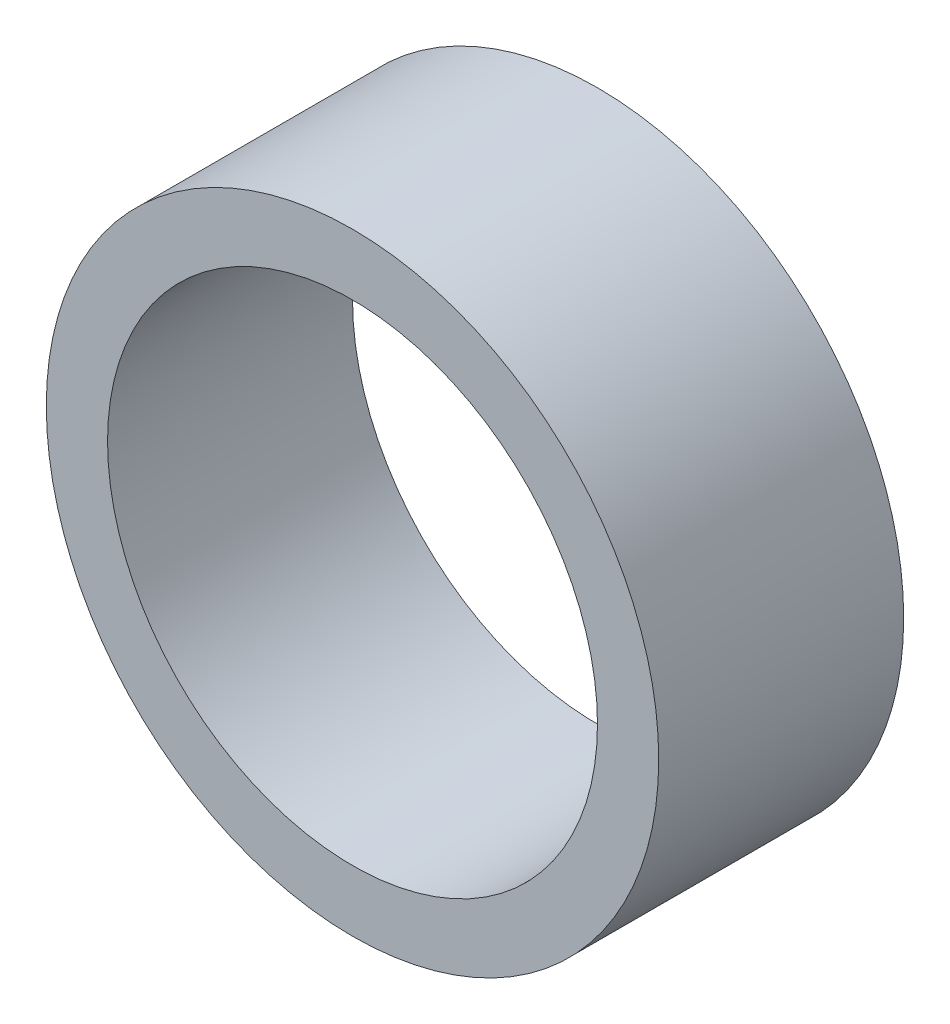
from build123d import *

# Parameters (mm, degrees)
SKETCH1_R           = 6.25
SKETCH1_R_2         = 5
BOSS_EXTRUDE1_DEPTH = 5


with BuildPart() as part:
    # Sketch1 → Boss-Extrude1 (new body)
    with BuildSketch(Plane(origin=(0, 0, 0), x_dir=(0, 1, 0), z_dir=(0, 0, 1))):
        with Locations(Location((0, 0, 0), (0, 0, 270))):
            Circle(SKETCH1_R)
        with Locations(Location((0, 0, 0), (0, 0, 270))):
            Circle(SKETCH1_R_2, mode=Mode.SUBTRACT)
    extrude(amount=BOSS_EXTRUDE1_DEPTH)


solid = part.part
